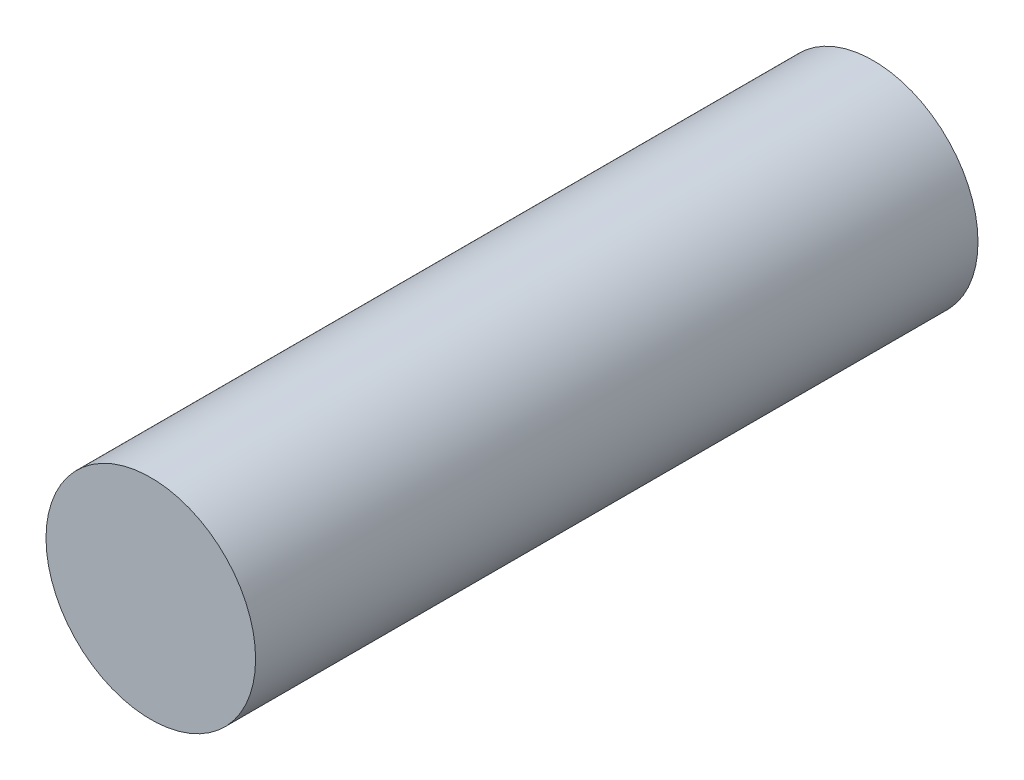
from build123d import *

# Parameters (mm, degrees)
SK_AXLE_R      = 7.62
EXT_AXLE_DEPTH = 26.2636


with BuildPart() as part:
    # Sk_axle → Ext_axle (new, symmetric)
    with BuildSketch(Plane.XY):
        with Locations((38.481, -19.05)):
            Circle(SK_AXLE_R)
    extrude(amount=EXT_AXLE_DEPTH, both=True)


solid = part.part
